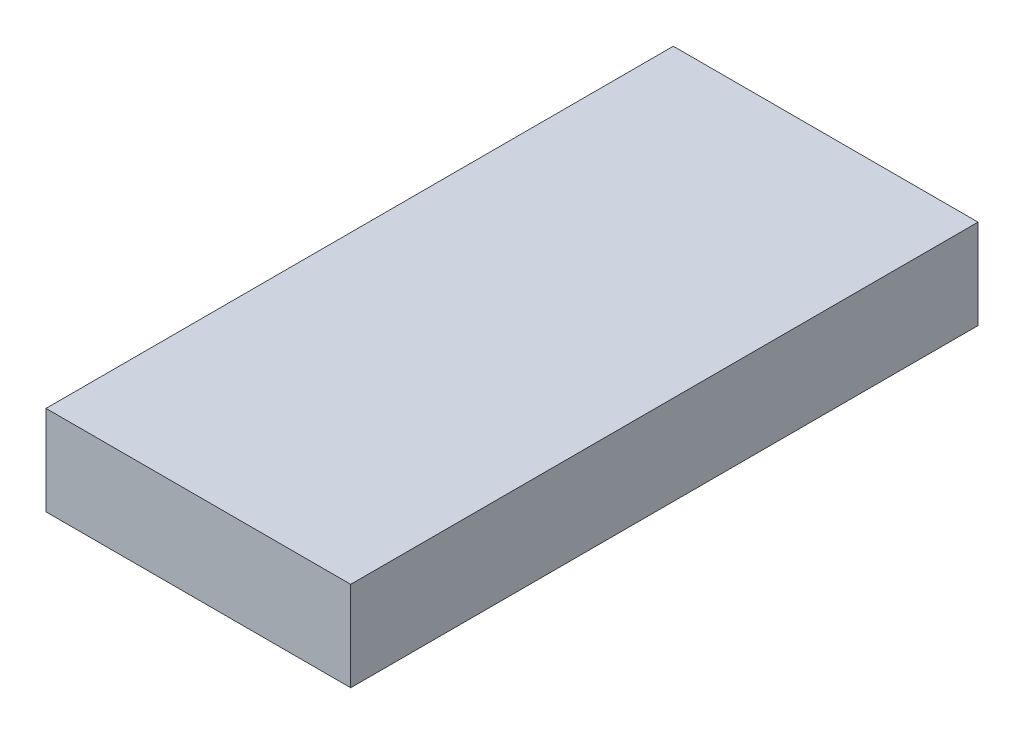
from build123d import *

# Parameters (mm, degrees)
SKETCH2_W           = 17
SKETCH2_H           = 35
BOSS_EXTRUDE1_DEPTH = 5


with BuildPart() as part:
    # Sketch2 → Boss-Extrude1 (new body)
    with BuildSketch(Plane(origin=(0, 0, 0), x_dir=(1, 0, 0), z_dir=(0, 1, 0))):
        Rectangle(SKETCH2_W, SKETCH2_H)
    extrude(amount=BOSS_EXTRUDE1_DEPTH)


solid = part.part
